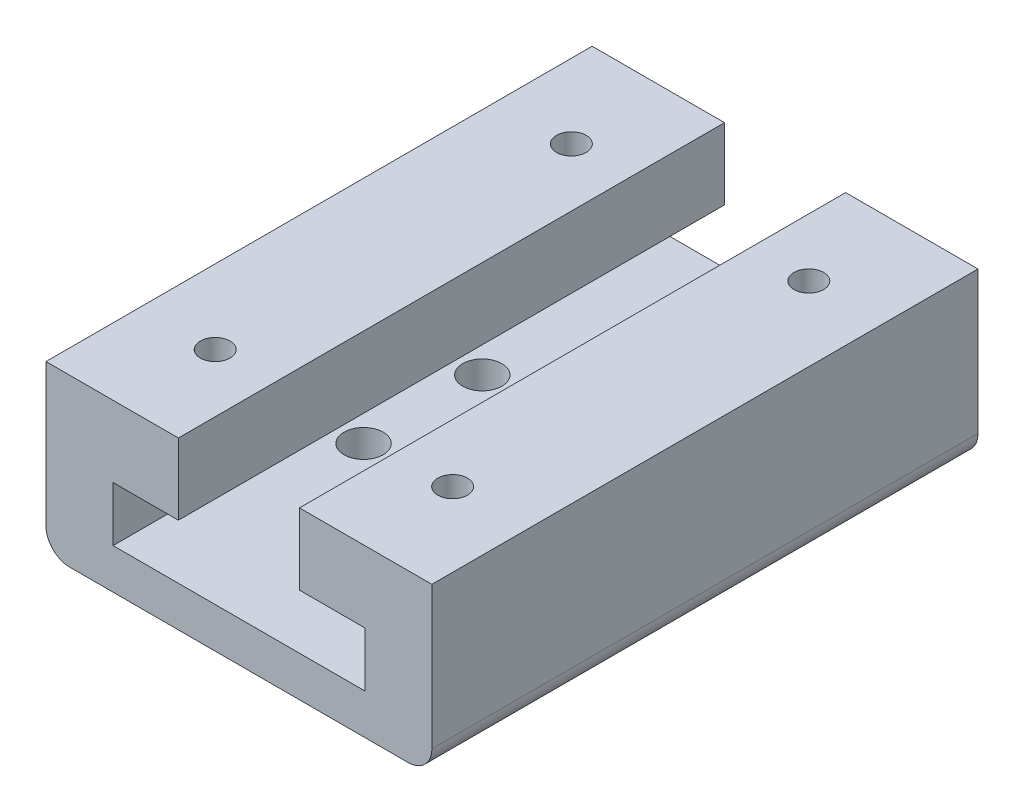
from build123d import *

# Parameters (mm, degrees)
SKETCH_1_W          = 32.5
SKETCH_1_H          = 46
EXTRUDE_1_DEPTH     = 14
SKETCH_2_W          = 10.2
SKETCH_2_H          = 6
CUT_EXTRUDE_2_DEPTH = 51.754925869
CUT_EXTRUDE_3_REACH = 33.449
SKETCH_4_R          = 1.65
SKETCH_5_R          = 1.25
CUT_EXTRUDE_4_DEPTH = 2
FILLET_1_R          = 2


with BuildPart() as part:
    # 草图1 → 凸台-拉伸1 (new body)
    with BuildSketch(Plane(origin=(0, 0, 0), x_dir=(1, 0, 0), z_dir=(0, 1, 0))):
        Rectangle(SKETCH_1_W, SKETCH_1_H)
    extrude(amount=EXTRUDE_1_DEPTH)

    # 草图2 → 切除-拉伸2 (cut, through all)
    with BuildSketch(Plane(origin=(0, 0, -23), x_dir=(-1, 0, 0), z_dir=(0, 0, -1))):
        with Locations((0, 11)):
            Rectangle(SKETCH_2_W, SKETCH_2_H)
        Polygon((5.1, 8), (-5.1, 8), (-10.6, 8), (-10.6, 3.4), (10.6, 3.4), (10.6, 8), align=None)
    extrude(amount=-CUT_EXTRUDE_2_DEPTH, mode=Mode.SUBTRACT)

    # 草图4 → 切除-拉伸3 (cut, up to next)
    with BuildSketch(Plane.XZ, mode=Mode.PRIVATE) as cut_extrude_3_sk1:
        with Locations(Location((-7.5, 5, 0), (0, 0, 270))):
            Circle(SKETCH_4_R)
    cut_extrude_3_tool1 = extrude(cut_extrude_3_sk1.sketch, amount=-CUT_EXTRUDE_3_REACH, mode=Mode.PRIVATE) & part.part
    # 草图4 → 切除-拉伸3 (cut, up to next)
    with BuildSketch(Plane.XZ, mode=Mode.PRIVATE) as cut_extrude_3_sk2:
        with Locations(Location((7.5, 5, 0), (0, 0, 270))):
            Circle(SKETCH_4_R)
    cut_extrude_3_tool2 = extrude(cut_extrude_3_sk2.sketch, amount=-CUT_EXTRUDE_3_REACH, mode=Mode.PRIVATE) & part.part
    # 草图4 → 切除-拉伸3 (cut, up to next)
    with BuildSketch(Plane.XZ, mode=Mode.PRIVATE) as cut_extrude_3_sk3:
        with Locations(Location((7.5, -5, 0), (0, 0, 270))):
            Circle(SKETCH_4_R)
    cut_extrude_3_tool3 = extrude(cut_extrude_3_sk3.sketch, amount=-CUT_EXTRUDE_3_REACH, mode=Mode.PRIVATE) & part.part
    # 草图4 → 切除-拉伸3 (cut, up to next)
    with BuildSketch(Plane.XZ, mode=Mode.PRIVATE) as cut_extrude_3_sk4:
        with Locations(Location((-7.5, -5, 0), (0, 0, 270))):
            Circle(SKETCH_4_R)
    cut_extrude_3_tool4 = extrude(cut_extrude_3_sk4.sketch, amount=-CUT_EXTRUDE_3_REACH, mode=Mode.PRIVATE) & part.part
    add(cut_extrude_3_tool1.solids().sort_by_distance((-7.5, 0, 5))[0], mode=Mode.SUBTRACT)
    add(cut_extrude_3_tool2.solids().sort_by_distance((7.5, 0, 5))[0], mode=Mode.SUBTRACT)
    add(cut_extrude_3_tool3.solids().sort_by_distance((7.5, 0, -5))[0], mode=Mode.SUBTRACT)
    add(cut_extrude_3_tool4.solids().sort_by_distance((-7.5, 0, -5))[0], mode=Mode.SUBTRACT)

    # 草图5 → 切除-拉伸4 (cut)
    with BuildSketch(Plane(origin=(0, 14, 0), x_dir=(1, 0, 0), z_dir=(0, 1, 0))):
        with Locations(Location((-10, 15, 0), (0, 0, 270))):
            Circle(SKETCH_5_R)
        with Locations(Location((10, 15, 0), (0, 0, 270))):
            Circle(SKETCH_5_R)
        with Locations(Location((10, -15, 0), (0, 0, 270))):
            Circle(SKETCH_5_R)
        with Locations(Location((-10, -15, 0), (0, 0, 270))):
            Circle(SKETCH_5_R)
    extrude(amount=-CUT_EXTRUDE_4_DEPTH, mode=Mode.SUBTRACT)

    # 圆角1
    fillet_1_edges = [part.edges().sort_by_distance(p)[0] for p in [
        (16.25, 0, 0),
        (-16.25, 0, 0),
    ]]
    fillet(fillet_1_edges, radius=FILLET_1_R)


solid = part.part
